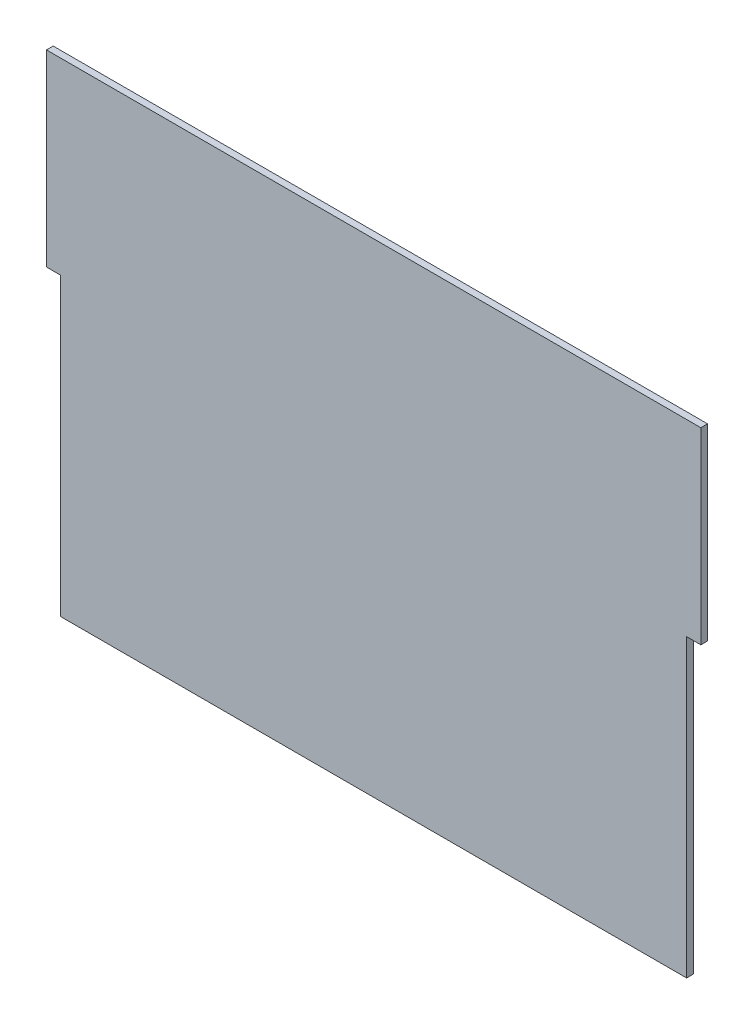
from build123d import *

# Parameters (mm, degrees)
SKETCH1_W           = 6.35
SKETCH1_H           = 71.247
BOSS_EXTRUDE1_DEPTH = 2.9972


with BuildPart() as part:
    # Sketch1 → Boss-Extrude1 (new body)
    with BuildSketch(Plane.XY):
        Polygon((0, 107.95), (-146.05, 107.95), (-146.05, 95.25), (-139.7, 95.25), (-139.7, 24.003), (-139.7, -107.95), (0, -107.95), align=None)
        with Locations((-142.875, 59.6265)):
            Rectangle(SKETCH1_W, SKETCH1_H)
        Polygon((146.05, 107.95), (0, 107.95), (0, -107.95), (139.7, -107.95), (139.7, 24.003), (139.7, 95.25), (146.05, 95.25), align=None)
        with Locations((142.875, 59.6265)):
            Rectangle(SKETCH1_W, SKETCH1_H)
    extrude(amount=BOSS_EXTRUDE1_DEPTH)


solid = part.part
